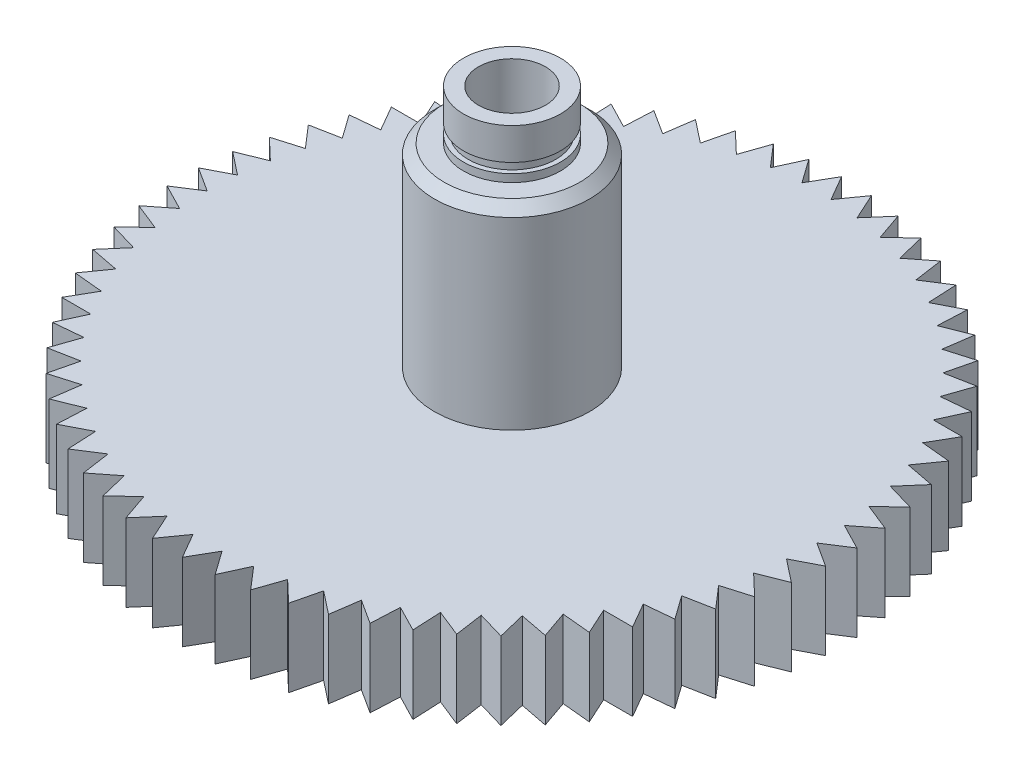
from build123d import *

# Parameters (mm, degrees)
BOSS_EXTRUDE1_DEPTH = 4
SKETCH2_R           = 4
BOSS_EXTRUDE2_DEPTH = 12.55
CUT_EXTRUDE1_START  = -2.55
SKETCH3_R           = 4
SKETCH3_R_2         = 2.5
CUT_EXTRUDE1_DEPTH  = 2.55
CUT_EXTRUDE2_REACH  = 31.176
SKETCH4_R           = 1.725
CUT_EXTRUDE3_START  = -2.15
SKETCH5_R           = 2.5
SKETCH5_R_2         = 2.259704792
CUT_EXTRUDE3_DEPTH  = 0.5
CHAMFER1_SIZE       = 0.5
SKETCH6_R           = 3.064739397
SKETCH6_R_2         = 1.725
BOSS_EXTRUDE3_DEPTH = 3.65
SKETCH7_R           = 3.064739397
SKETCH7_R_2         = 2.5
CUT_EXTRUDE5_DEPTH  = 2.5
CUT_EXTRUDE6_START  = -1.65
SKETCH8_R           = 2.5
SKETCH8_R_2         = 2.259704792
CUT_EXTRUDE6_DEPTH  = 0.5
BOSS_EXTRUDE4_START = 1.15
SKETCH9_R           = 4
BOSS_EXTRUDE4_DEPTH = 1.15


with BuildPart() as part:
    # Sketch1 → Boss-Extrude1 (new body)
    with BuildSketch(Plane(origin=(0, 0, 0), x_dir=(1, 0, 0), z_dir=(0, 1, 0))):
        Polygon((0, 17), (0.748086847, 15.704275572), (1.615952736, 16.923022684), (2.237485751, 15.562055221), (3.217271154, 16.692787853), (3.706621637, 15.278902488), (4.789453466, 16.311380551), (5.142189784, 14.857381647), (6.318261746, 15.782254861), (6.531189464, 14.301310058), (7.789850869, 15.110202627), (7.86104168, 13.61572359), (9.190893897, 14.301310058), (9.119703086, 12.806831021), (10.508702766, 13.362902611), (10.295775048, 11.881957807), (11.731343195, 12.303478648), (11.378606878, 10.849479744), (12.847742764, 11.132632477), (12.358392281, 9.718747111), (13.847791185, 9.860967463), (13.22625817, 8.5), (14.722431864, 8.5), (13.974345017, 7.204275572), (15.463743921, 7.062055221), (14.595878032, 5.84330811), (16.065013918, 5.560155376), (15.085228515, 4.429422744), (16.520796662, 4.007901904), (15.437964832, 2.97542384), (16.826964512, 2.419352251), (15.650892549, 1.494479037), (16.980744766, 0.808892569), (15.72208336, 0), (16.980744766, -0.808892569), (15.650892549, -1.494479037), (16.826964512, -2.419352251), (15.437964832, -2.97542384), (16.520796662, -4.007901904), (15.085228515, -4.429422744), (16.065013918, -5.560155376), (14.595878032, -5.84330811), (15.463743921, -7.062055221), (13.974345017, -7.204275572), (14.722431864, -8.5), (13.22625817, -8.5), (13.847791185, -9.860967463), (12.358392281, -9.718747111), (12.847742764, -11.132632477), (11.378606878, -10.849479744), (11.731343195, -12.303478648), (10.295775048, -11.881957807), (10.508702766, -13.362902611), (9.119703086, -12.806831021), (9.190893897, -14.301310058), (7.86104168, -13.61572359), (7.789850869, -15.110202627), (6.531189464, -14.301310058), (6.318261746, -15.782254861), (5.142189784, -14.857381647), (4.789453466, -16.311380551), (3.706621637, -15.278902488), (3.217271154, -16.692787853), (2.237485751, -15.562055221), (1.615952736, -16.923022684), (0.748086847, -15.704275572), (0, -17), (-0.748086847, -15.704275572), (-1.615952736, -16.923022684), (-2.237485751, -15.562055221), (-3.217271154, -16.692787853), (-3.706621637, -15.278902488), (-4.789453466, -16.311380551), (-5.142189784, -14.857381647), (-6.318261746, -15.782254861), (-6.531189464, -14.301310058), (-7.789850869, -15.110202627), (-7.86104168, -13.61572359), (-9.190893897, -14.301310058), (-9.119703086, -12.806831021), (-10.508702766, -13.362902611), (-10.295775048, -11.881957807), (-11.731343195, -12.303478648), (-11.378606878, -10.849479744), (-12.847742764, -11.132632477), (-12.358392281, -9.718747111), (-13.847791185, -9.860967463), (-13.22625817, -8.5), (-14.722431864, -8.5), (-13.974345017, -7.204275572), (-15.463743921, -7.062055221), (-14.595878032, -5.84330811), (-16.065013918, -5.560155376), (-15.085228515, -4.429422744), (-16.520796662, -4.007901904), (-15.437964832, -2.97542384), (-16.826964512, -2.419352251), (-15.650892549, -1.494479037), (-16.980744766, -0.808892569), (-15.72208336, 0), (-16.980744766, 0.808892569), (-15.650892549, 1.494479037), (-16.826964512, 2.419352251), (-15.437964832, 2.97542384), (-16.520796662, 4.007901904), (-15.085228515, 4.429422744), (-16.065013918, 5.560155376), (-14.595878032, 5.84330811), (-15.463743921, 7.062055221), (-13.974345017, 7.204275572), (-14.722431864, 8.5), (-13.22625817, 8.5), (-13.847791185, 9.860967463), (-12.358392281, 9.718747111), (-12.847742764, 11.132632477), (-11.378606878, 10.849479744), (-11.731343195, 12.303478648), (-10.295775048, 11.881957807), (-10.508702766, 13.362902611), (-9.119703086, 12.806831021), (-9.190893897, 14.301310058), (-7.86104168, 13.61572359), (-7.789850869, 15.110202627), (-6.531189464, 14.301310058), (-6.318261746, 15.782254861), (-5.142189784, 14.857381647), (-4.789453466, 16.311380551), (-3.706621637, 15.278902488), (-3.217271154, 16.692787853), (-2.237485751, 15.562055221), (-1.615952736, 16.923022684), (-0.748086847, 15.704275572), align=None)
    extrude(amount=BOSS_EXTRUDE1_DEPTH)

    # Sketch2 → Boss-Extrude2 (add)
    with BuildSketch(Plane(origin=(0, 4, 0), x_dir=(1, 0, 0), z_dir=(0, 1, 0))):
        with Locations(Location((0, 0, 0), (0, 0, 270))):
            Circle(SKETCH2_R)
    extrude(amount=BOSS_EXTRUDE2_DEPTH)

    # Sketch3 → Cut-Extrude1 (cut)
    with BuildSketch(Plane(origin=(0, 16.55, 0), x_dir=(1, 0, 0), z_dir=(0, 1, 0)).offset(CUT_EXTRUDE1_START)):
        with Locations(Location((0, 0, 0), (0, 0, 270))):
            Circle(SKETCH3_R)
        with Locations(Location((0, 0, 0), (0, 0, 270))):
            Circle(SKETCH3_R_2, mode=Mode.SUBTRACT)
    extrude(amount=CUT_EXTRUDE1_DEPTH, mode=Mode.SUBTRACT)

    # Sketch4 → Cut-Extrude2 (cut, up to next)
    with BuildSketch(Plane(origin=(0, 16.55, 0), x_dir=(1, 0, 0), z_dir=(0, 1, 0)), mode=Mode.PRIVATE) as cut_extrude2_sk1:
        with Locations(Location((0, 0, 0), (0, 0, 270))):
            Circle(SKETCH4_R)
    cut_extrude2_tool1 = extrude(cut_extrude2_sk1.sketch, amount=-CUT_EXTRUDE2_REACH, mode=Mode.PRIVATE) & part.part
    add(cut_extrude2_tool1.solids().sort_by_distance((0, 16.55, 0))[0], mode=Mode.SUBTRACT)

    # Sketch5 → Cut-Extrude3 (cut)
    with BuildSketch(Plane(origin=(0, 16.55, 0), x_dir=(1, 0, 0), z_dir=(0, 1, 0)).offset(CUT_EXTRUDE3_START)):
        with Locations(Location((0, 0, 0), (0, 0, 270))):
            Circle(SKETCH5_R)
        with Locations(Location((0, 0, 0), (0, 0, 270))):
            Circle(SKETCH5_R_2, mode=Mode.SUBTRACT)
    extrude(amount=CUT_EXTRUDE3_DEPTH, mode=Mode.SUBTRACT)

    # Chamfer1
    chamfer1_edges = [part.edges().sort_by_distance(p)[0] for p in [
        (0, 14, -4),
    ]]
    chamfer(chamfer1_edges, length=CHAMFER1_SIZE)

    # Sketch6 → Boss-Extrude3 (add)
    with BuildSketch(Plane(origin=(0, 0, 0), x_dir=(-1, 0, 0), z_dir=(0, -1, 0))):
        with Locations(Location((0, 0, 0), (0, 0, 270))):
            Circle(SKETCH6_R)
        with Locations(Location((0, 0, 0), (0, 0, 270))):
            Circle(SKETCH6_R_2, mode=Mode.SUBTRACT)
    extrude(amount=BOSS_EXTRUDE3_DEPTH)

    # Sketch7 → Cut-Extrude5 (cut)
    with BuildSketch(Plane(origin=(0, -3.65, 0), x_dir=(-1, 0, 0), z_dir=(0, -1, 0))):
        with Locations(Location((0, 0, 0), (0, 0, 270))):
            Circle(SKETCH7_R)
        with Locations(Location((0, 0, 0), (0, 0, 270))):
            Circle(SKETCH7_R_2, mode=Mode.SUBTRACT)
    extrude(amount=-CUT_EXTRUDE5_DEPTH, mode=Mode.SUBTRACT)

    # Sketch8 → Cut-Extrude6 (cut)
    with BuildSketch(Plane.XZ.offset(3.65).offset(CUT_EXTRUDE6_START)):
        with Locations(Location((0, 0, 0), (0, 0, 270))):
            Circle(SKETCH8_R)
        with Locations(Location((0, 0, 0), (0, 0, 90))):
            Circle(SKETCH8_R_2, mode=Mode.SUBTRACT)
    extrude(amount=-CUT_EXTRUDE6_DEPTH, mode=Mode.SUBTRACT)

    # Sketch9 → Boss-Extrude4 (add)
    with BuildSketch(Plane.XZ.offset(BOSS_EXTRUDE4_START)):
        with Locations(Location((0, 0, 0), (0, 0, 90))):
            Circle(SKETCH9_R)
    extrude(amount=-BOSS_EXTRUDE4_DEPTH)


solid = part.part
